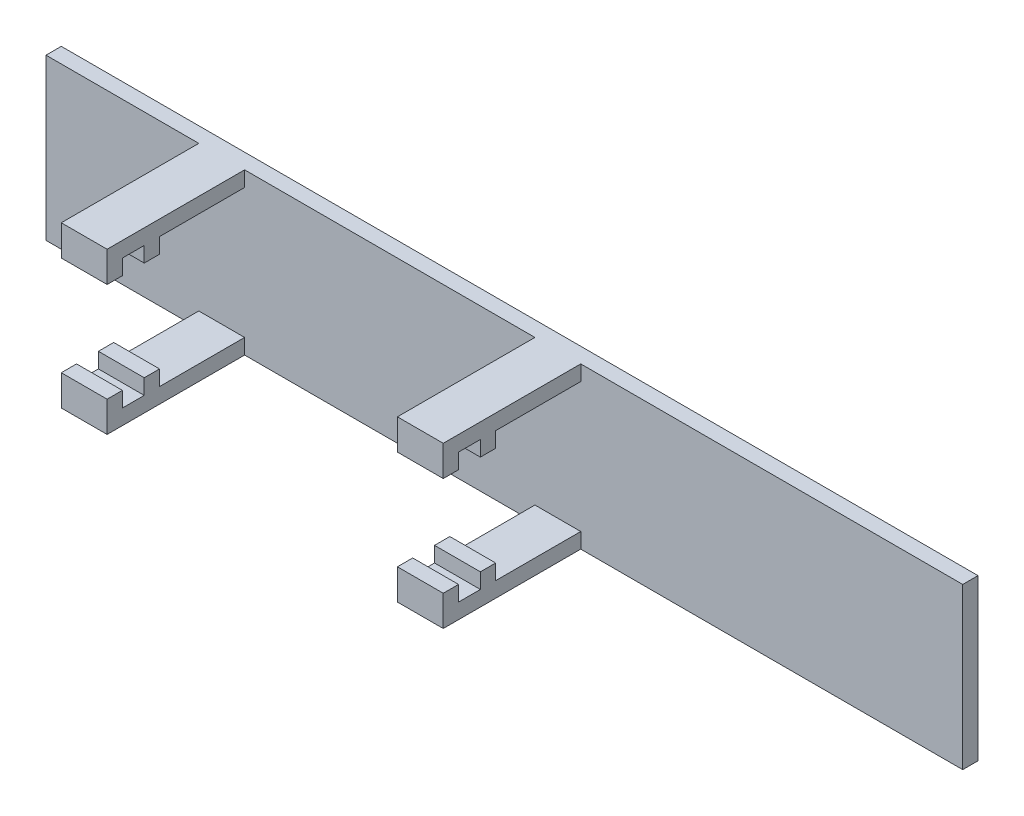
from build123d import *

# Parameters (mm, degrees)
SKETCH1_W           = 60
SKETCH1_H           = 10.5
BOSS_EXTRUDE1_DEPTH = 1
SKETCH2_W           = 3
SKETCH2_H           = 10
BOSS_EXTRUDE2_DEPTH = 1
SKETCH3_W           = 3
SKETCH3_H           = 3.43
BOSS_EXTRUDE3_DEPTH = 1
SKETCH4_W           = 3
SKETCH4_H           = 1.43
CUT_EXTRUDE1_DEPTH  = 1
SKETCH6_W           = 3
SKETCH6_H           = 10
BOSS_EXTRUDE4_DEPTH = 1
SKETCH7_W           = 3
SKETCH7_H           = 3.43
BOSS_EXTRUDE5_DEPTH = 1
SKETCH8_W           = 3
SKETCH8_H           = 1.43
CUT_EXTRUDE2_DEPTH  = 1
SKETCH9_W           = 3
SKETCH9_H           = 10
BOSS_EXTRUDE6_DEPTH = 1
SKETCH10_W          = 3
SKETCH10_H          = 3.43
BOSS_EXTRUDE7_DEPTH = 1
SKETCH11_W          = 3
SKETCH11_H          = 1.43
CUT_EXTRUDE3_DEPTH  = 1
SKETCH12_W          = 3
SKETCH12_H          = 10
BOSS_EXTRUDE8_DEPTH = 1
SKETCH13_W          = 3
SKETCH13_H          = 3.43
BOSS_EXTRUDE9_DEPTH = 1
SKETCH14_W          = 3
SKETCH14_H          = 1.43
CUT_EXTRUDE4_DEPTH  = 1


with BuildPart() as part:
    # Sketch1 → Boss-Extrude1 (new body)
    with BuildSketch(Plane.XY):
        with Locations((30, 5.25)):
            Rectangle(SKETCH1_W, SKETCH1_H)
    extrude(amount=BOSS_EXTRUDE1_DEPTH)

    # Sketch2 → Boss-Extrude2 (add)
    with BuildSketch(Plane.XZ):
        with Locations((11.5, 5)):
            Rectangle(SKETCH2_W, SKETCH2_H)
    extrude(amount=-BOSS_EXTRUDE2_DEPTH)

    # Sketch3 → Boss-Extrude3 (add)
    with BuildSketch(Plane(origin=(0, 1, 0), x_dir=(1, 0, 0), z_dir=(0, 1, 0))):
        with Locations((11.5, -8.285)):
            Rectangle(SKETCH3_W, SKETCH3_H)
    extrude(amount=BOSS_EXTRUDE3_DEPTH)

    # Sketch4 → Cut-Extrude1 (cut)
    with BuildSketch(Plane(origin=(0, 2, 0), x_dir=(1, 0, 0), z_dir=(0, 1, 0))):
        with Locations((11.5, -8.285)):
            Rectangle(SKETCH4_W, SKETCH4_H)
    extrude(amount=-CUT_EXTRUDE1_DEPTH, mode=Mode.SUBTRACT)

    # Sketch6 → Boss-Extrude4 (add)
    with BuildSketch(Plane(origin=(0, 10.5, 0), x_dir=(1, 0, 0), z_dir=(0, 1, 0))):
        with Locations((11.5, -5)):
            Rectangle(SKETCH6_W, SKETCH6_H)
    extrude(amount=-BOSS_EXTRUDE4_DEPTH)

    # Sketch7 → Boss-Extrude5 (add)
    with BuildSketch(Plane.XZ.offset(-9.5)):
        with Locations((11.5, 8.285)):
            Rectangle(SKETCH7_W, SKETCH7_H)
    extrude(amount=BOSS_EXTRUDE5_DEPTH)

    # Sketch8 → Cut-Extrude2 (cut)
    with BuildSketch(Plane.XZ.offset(-8.5)):
        with Locations((11.5, 8.285)):
            Rectangle(SKETCH8_W, SKETCH8_H)
    extrude(amount=-CUT_EXTRUDE2_DEPTH, mode=Mode.SUBTRACT)

    # Sketch9 → Boss-Extrude6 (add)
    with BuildSketch(Plane.XZ):
        with Locations((33.5, 5)):
            Rectangle(SKETCH9_W, SKETCH9_H)
    extrude(amount=-BOSS_EXTRUDE6_DEPTH)

    # Sketch10 → Boss-Extrude7 (add)
    with BuildSketch(Plane(origin=(0, 1, 0), x_dir=(1, 0, 0), z_dir=(0, 1, 0))):
        with Locations((33.5, -8.285)):
            Rectangle(SKETCH10_W, SKETCH10_H)
    extrude(amount=BOSS_EXTRUDE7_DEPTH)

    # Sketch11 → Cut-Extrude3 (cut)
    with BuildSketch(Plane(origin=(0, 2, 0), x_dir=(1, 0, 0), z_dir=(0, 1, 0))):
        with Locations((33.5, -8.285)):
            Rectangle(SKETCH11_W, SKETCH11_H)
    extrude(amount=-CUT_EXTRUDE3_DEPTH, mode=Mode.SUBTRACT)

    # Sketch12 → Boss-Extrude8 (add)
    with BuildSketch(Plane(origin=(0, 10.5, 0), x_dir=(1, 0, 0), z_dir=(0, 1, 0))):
        with Locations((33.5, -5)):
            Rectangle(SKETCH12_W, SKETCH12_H)
    extrude(amount=-BOSS_EXTRUDE8_DEPTH)

    # Sketch13 → Boss-Extrude9 (add)
    with BuildSketch(Plane.XZ.offset(-9.5)):
        with Locations((33.5, 8.285)):
            Rectangle(SKETCH13_W, SKETCH13_H)
    extrude(amount=BOSS_EXTRUDE9_DEPTH)

    # Sketch14 → Cut-Extrude4 (cut)
    with BuildSketch(Plane.XZ.offset(-8.5)):
        with Locations((33.5, 8.285)):
            Rectangle(SKETCH14_W, SKETCH14_H)
    extrude(amount=-CUT_EXTRUDE4_DEPTH, mode=Mode.SUBTRACT)


solid = part.part
